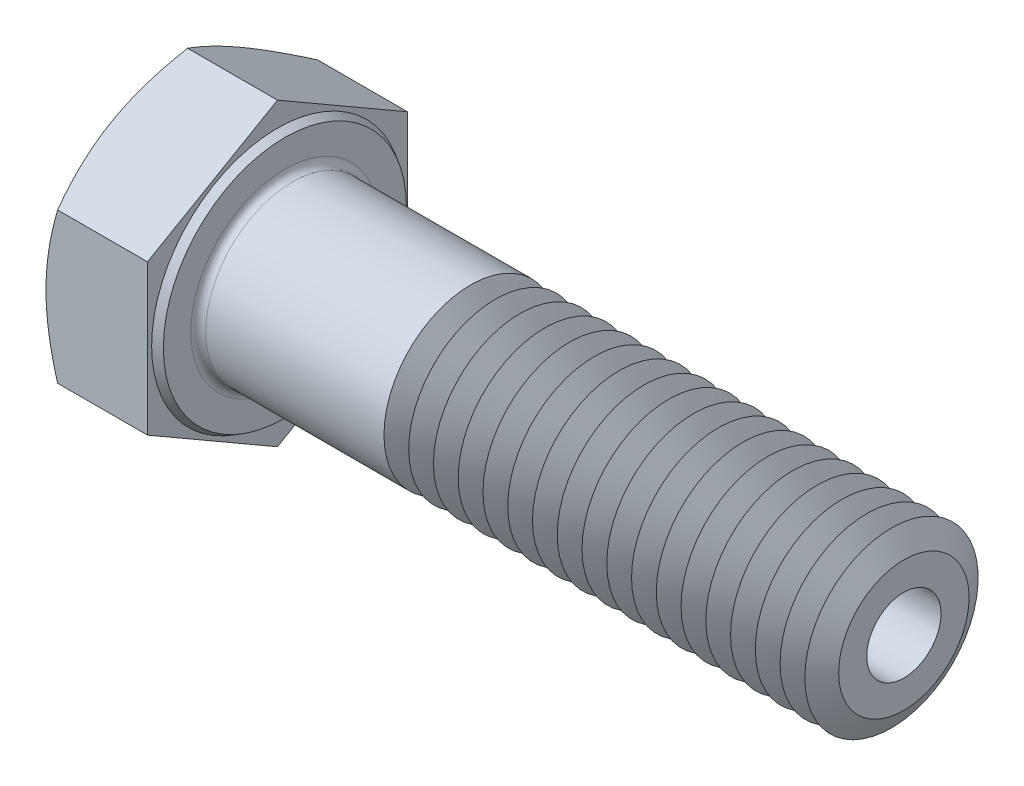
from build123d import *

# Parameters (mm, degrees)
EXTRUDE_419_DEPTH      = 8.8
FILLET_1296_R          = 0.6
PATTERN_LINEAR_1_COUNT = 18
PATTERN_LINEAR_1_PITCH = 2
HOLE_WIZARD_6_0_6_1_D  = 6
M8X1_0_1_D             = 7
M8X1_0_1_DEPTH         = 13
M8X1_0_1_TIP           = 2.103012167


with BuildPart() as part:
    # 草图1 → Extrude 419 (new body)
    with BuildSketch(Plane(origin=(0, 0, 0), x_dir=(0, 0, -1), z_dir=(1, 0, 0))):
        Polygon((10.5, 6.062177826), (10.5, -6.062177826), (0, -12.124355653), (-10.5, -6.062177826), (-10.5, 6.062177826), (0, 12.124355653), align=None)
    extrude(amount=EXTRUDE_419_DEPTH)

    # 草图2 → 凸台-旋转1 (revolve)
    with BuildSketch(Plane.XY, mode=Mode.PRIVATE) as revolve_1_sk:
        Polygon((0, 0), (58.8, 0), (58.8, 5.268), (58.8, 7), (0, 7), align=None)
    revolve(revolve_1_sk.sketch.rotate(Axis((0, 0, 0), (1, 0, 0)), 90), axis=Axis((0, 0, 0), (1, 0, 0)))

    # 草图3 → 切除-旋转1 (revolve, cut)
    with BuildSketch(Plane.XY):
        Polygon((0, 10.5), (3.824573519, 17.124355653), (3.824573519, 22.124355653), (-10, 22.124355653), (-10, 10.5), align=None)
    revolve(axis=Axis((0, 0, 0), (1, 0, 0)), mode=Mode.SUBTRACT)

    # 草图4 → 切除-旋转3 (revolve, cut)
    with BuildSketch(Plane.XY, mode=Mode.PRIVATE) as cut_revolve_3_sk:
        Polygon((8.8, 9.82), (8.2, 10.166410162), (8.2, 12.124355653), (8.8, 12.124355653), align=None)
    revolve(cut_revolve_3_sk.sketch.rotate(Axis((0, 0, 0), (1, 0, 0)), 90), axis=Axis((0, 0, 0), (1, 0, 0)), mode=Mode.SUBTRACT)

    # Fillet 1296
    fillet_1296_edges = [part.edges().sort_by_distance(p)[0] for p in [
        (8.8, 0, -7),
    ]]
    fillet(fillet_1296_edges, radius=FILLET_1296_R)

    # 草图6 → 切除-旋转4 (revolve, cut)
    with BuildSketch(Plane.XY, mode=Mode.PRIVATE) as cut_revolve_4_sk:
        Polygon((57.8, 7), (59.8, 7), (58.8, 5.267949192), align=None)
    cut_revolve_4 = revolve(cut_revolve_4_sk.sketch.rotate(Axis((0, 0, 0), (1, 0, 0)), 90), axis=Axis((0, 0, 0), (1, 0, 0)), mode=Mode.SUBTRACT)

    # 阵列(线性)1: 切除-旋转4 ×18
    with Locations(*[(-i * PATTERN_LINEAR_1_PITCH, 0, 0) for i in range(1, PATTERN_LINEAR_1_COUNT)]):
        add(cut_revolve_4, mode=Mode.SUBTRACT)

    # Ø6.0 (6) 直径孔1 (through all)
    with Locations(Plane(origin=(0, 0, 0), x_dir=(0, 0, -1), z_dir=(-1, 0, 0))):
        with Locations((0, 0)):
            Hole(HOLE_WIZARD_6_0_6_1_D / 2)

    # M8x1.0 螺纹孔1
    with Locations(Plane(origin=(0, 0, 0), x_dir=(0, 0, -1), z_dir=(-1, 0, 0))):
        with Locations((0, 0)):
            Hole(M8X1_0_1_D / 2, depth=M8X1_0_1_DEPTH)
            with Locations((0, 0, -(M8X1_0_1_DEPTH + M8X1_0_1_TIP / 2))):  # 118° drill point
                Cone(0, M8X1_0_1_D / 2, M8X1_0_1_TIP, mode=Mode.SUBTRACT)


solid = part.part
